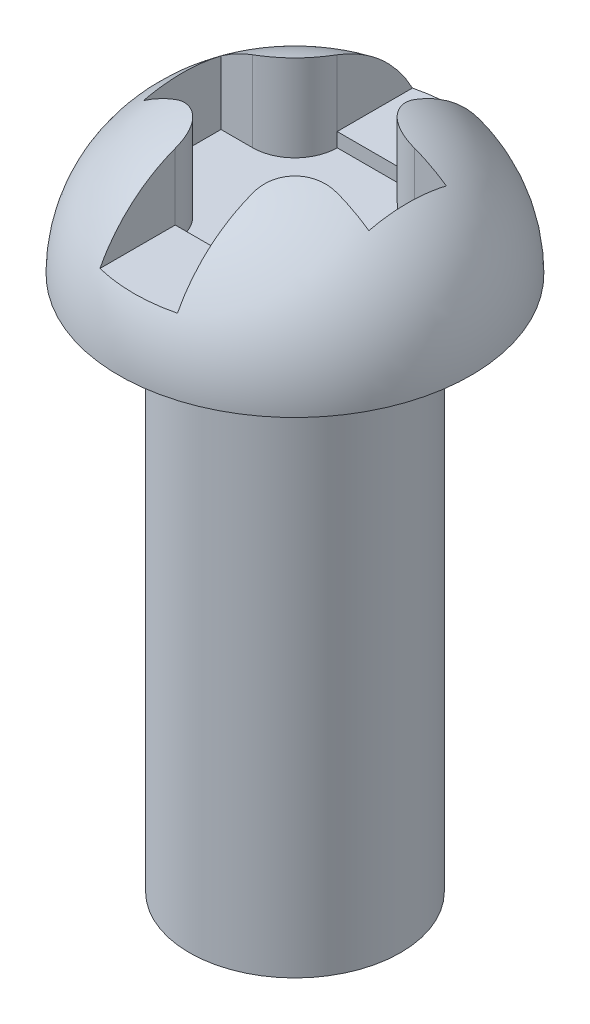
from build123d import *

# Parameters (mm, degrees)
SKETCH3_W           = 1.1
SKETCH3_H           = 4.9
CUT_EXTRUDE1_DEPTH  = 1.1
SKETCH4_W           = 3.2
SKETCH4_H           = 1.1
CUT_EXTRUDE2_DEPTH  = 4.702516225
FILLET1_R           = 0.6
CUT_EXTRUDE3_DEPTH  = 0.2
SKETCH2_R           = 1.5
BOSS_EXTRUDE1_DEPTH = 7.6


with BuildPart() as part:
    # Sketch1 → Revolve1 (revolve)
    with BuildSketch(Plane(origin=(0, 0, 0), x_dir=(0, 0, -1), z_dir=(1, 0, 0))):
        with BuildLine():
            Line((0, 2), (0, 0))
            Line((0, 0), (2.5, 0))
            ThreePointArc((2.5, 0), (1.914213562, 1.414213562), (0.5, 2))
            Line((0.5, 2), (0, 2))
        make_face()
    revolve(axis=Axis((0, 0, 0), (0, 1, 0)))

    # Sketch3 → Cut-Extrude1 (cut)
    with BuildSketch(Plane(origin=(0, 2, 0), x_dir=(1, 0, 0), z_dir=(0, 1, 0))):
        Rectangle(SKETCH3_W, SKETCH3_H)
    extrude(amount=-CUT_EXTRUDE1_DEPTH, mode=Mode.SUBTRACT)

    # Sketch4 → Cut-Extrude2 (cut, through all)
    with BuildSketch(Plane(origin=(0, 0.9, 0), x_dir=(1, 0, 0), z_dir=(0, 1, 0))):
        Rectangle(SKETCH4_W, SKETCH4_H)
    extrude(amount=CUT_EXTRUDE2_DEPTH, mode=Mode.SUBTRACT)

    # Fillet1
    fillet1_edges = [part.edges().sort_by_distance(p)[0] for p in [
        (0.55, 1.440305176, 0.55),
        (-0.55, 1.440305183, 0.55),
        (0.55, 1.440305183, -0.55),
        (-0.55, 1.440305176, -0.55),
    ]]
    fillet(fillet1_edges, radius=FILLET1_R)

    # Sketch5 → Cut-Extrude3 (cut)
    with BuildSketch(Plane(origin=(0, 0.9, 0), x_dir=(1, 0, 0), z_dir=(0, 1, 0))):
        with BuildLine():
            Line((-0.55, 1.15), (0.55, 1.15))
            ThreePointArc((0.55, 1.15), (0.725735931, 0.725735931), (1.15, 0.55))
            Line((1.15, 0.55), (1.6, 0.55))
            Line((1.6, 0.55), (1.6, -0.55))
            Line((1.6, -0.55), (1.15, -0.55))
            ThreePointArc((1.15, -0.55), (0.725735931, -0.725735931), (0.55, -1.15))
            Line((0.55, -1.15), (-0.55, -1.15))
            ThreePointArc((-0.55, -1.15), (-0.725735931, -0.725735931), (-1.15, -0.55))
            Line((-1.15, -0.55), (-1.6, -0.55))
            Line((-1.6, -0.55), (-1.6, 0.55))
            Line((-1.6, 0.55), (-1.15, 0.55))
            ThreePointArc((-1.15, 0.55), (-0.725735931, 0.725735931), (-0.55, 1.15))
        make_face()
    extrude(amount=-CUT_EXTRUDE3_DEPTH, mode=Mode.SUBTRACT)

    # Sketch2 → Boss-Extrude1 (add)
    with BuildSketch(Plane.XZ):
        with Locations(Location((0, 0, 0), (0, 0, 90))):
            Circle(SKETCH2_R)
    extrude(amount=BOSS_EXTRUDE1_DEPTH)


solid = part.part
